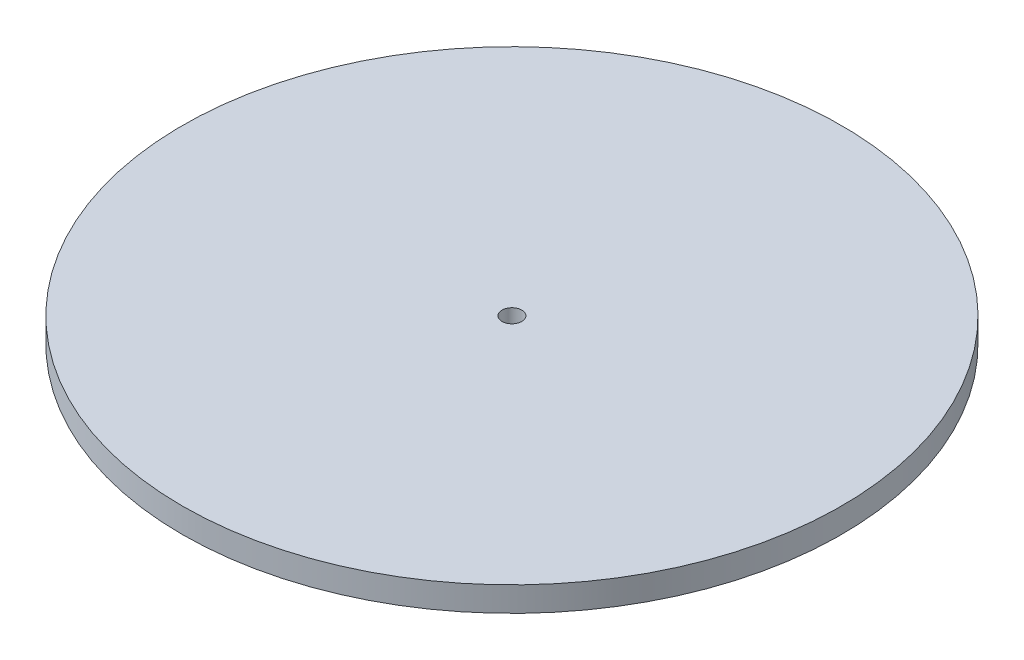
from build123d import *

# Parameters (mm, degrees)
SKETCH5_R          = 1.2
CUT_EXTRUDE1_DEPTH = 61.302405898


with BuildPart() as part:
    # Sketch3 → Revolve4 (revolve)
    with BuildSketch(Plane.XY, mode=Mode.PRIVATE) as revolve4_sk:
        with BuildLine():
            Line((1.2, 20.888717062), (1.2, 15.888717062))
            Line((1.2, 15.888717062), (0, 15.888717062))
            Line((0, 15.888717062), (0, 0))
            add(Edge.make_bspline(
                [(0, 0), (4.625000024, -0.068385853), (9.250000018, 2.563323273), (13.875000012, 5.193663343), (18.500000012, 7.377641156), (23.125000005, 10.121310962), (27.750000004, 12.318806226), (32.375000001, 14.680674666), (37, 16.888717062)],
                knots=[0.08315784, 0.08315784, 0.08315784, 0.08315784, 0.08315784, 0.08315784, 0.08315784, 0.08315784, 0.08315784, 0.916661178, 0.916661178, 0.916661178, 0.916661178, 0.916661178, 0.916661178, 0.916661178, 0.916661178, 0.916661178], degree=8))
            Line((37, 16.888717062), (37, 17.888717062))
            Line((37, 17.888717062), (40, 17.888717062))
            Line((40, 17.888717062), (40, 20.888717062))
            Line((40, 20.888717062), (1.2, 20.888717062))
        make_face()
    revolve(revolve4_sk.sketch.rotate(Axis((0, 20.888717062, 0), (0, -1, 0)), 90), axis=Axis((0, 20.888717062, 0), (0, -1, 0)))

    # Sketch5 → Cut-Extrude1 (cut, through all)
    with BuildSketch(Plane(origin=(0, 20.888717062, 0), x_dir=(1, 0, 0), z_dir=(0, 1, 0))):
        with Locations(Location((0, 0, 0), (0, 0, 270))):
            Circle(SKETCH5_R)
    extrude(amount=-CUT_EXTRUDE1_DEPTH, mode=Mode.SUBTRACT)


solid = part.part
